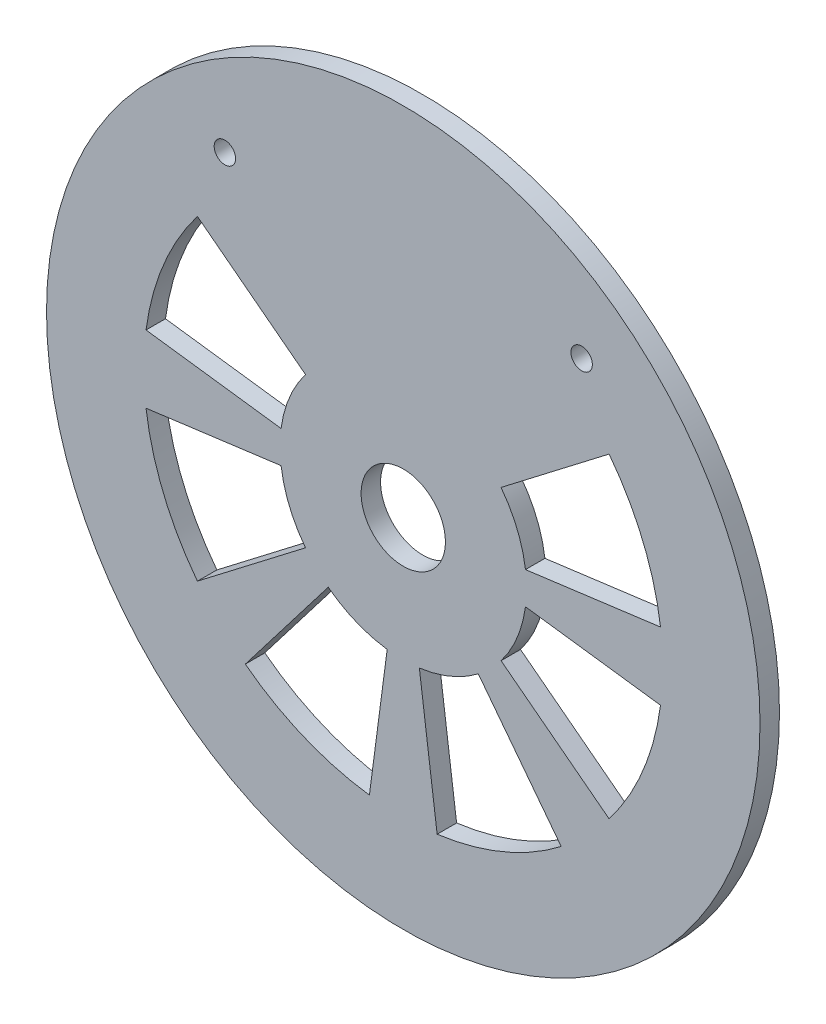
from build123d import *

# Parameters (mm, degrees)
SKETCH_1_R          = 55
EXTRUDE_1_DEPTH     = 3
SKETCH_3_R          = 1.65
CUT_EXTRUDE_1_DEPTH = 3
CUT_EXTRUDE_2_DEPTH = 3
SKETCH_5_R          = 6.5
CUT_EXTRUDE_3_DEPTH = 3


with BuildPart() as part:
    # 草图1 → 凸台-拉伸1 (new body)
    with BuildSketch(Plane.XY):
        Circle(SKETCH_1_R)
    extrude(amount=EXTRUDE_1_DEPTH)

    # 草图3 → 切除-拉伸1 (cut)
    with BuildSketch(Plane.XY.offset(3)):
        with Locations((27.5, 35)):
            Circle(SKETCH_3_R)
        with Locations((-27.5, 35)):
            Circle(SKETCH_3_R)
    extrude(amount=-CUT_EXTRUDE_1_DEPTH, mode=Mode.SUBTRACT)

    # 草图4 → 切除-拉伸2 (cut)
    with BuildSketch(Plane.XY.offset(3)):
        with BuildLine():
            ThreePointArc((15.073713466, 11.566467151), (17.553711118, 7.270985215), (18.837452366, 2.479997652))
            Line((18.837452366, 2.479997652), (39.657794455, 5.221047689))
            ThreePointArc((39.657794455, 5.221047689), (36.9551813, 15.307337295), (31.734133612, 24.35045716))
            Line((31.734133612, 24.35045716), (15.073713466, 11.566467151))
        make_face()
        with BuildLine():
            Line((-39.657794455, 5.221047689), (-18.837452366, 2.479997652))
            ThreePointArc((-18.837452366, 2.479997652), (-17.553711118, 7.270985215), (-15.073713466, 11.566467151))
            Line((-15.073713466, 11.566467151), (-31.734133612, 24.35045716))
            ThreePointArc((-31.734133612, 24.35045716), (-36.9551813, 15.307337295), (-39.657794455, 5.221047689))
        make_face()
        with BuildLine():
            Line((-31.734133612, -24.35045716), (-15.073713466, -11.566467151))
            ThreePointArc((-15.073713466, -11.566467151), (-17.553711118, -7.270985215), (-18.837452366, -2.479997652))
            Line((-18.837452366, -2.479997652), (-39.657794455, -5.221047689))
            ThreePointArc((-39.657794455, -5.221047689), (-36.9551813, -15.307337295), (-31.734133612, -24.35045716))
        make_face()
        with BuildLine():
            Line((-5.221047689, -39.657794455), (-2.479997652, -18.837452366))
            ThreePointArc((-2.479997652, -18.837452366), (-7.270985215, -17.553711118), (-11.566467151, -15.073713466))
            Line((-11.566467151, -15.073713466), (-24.35045716, -31.734133612))
            ThreePointArc((-24.35045716, -31.734133612), (-15.307337295, -36.9551813), (-5.221047689, -39.657794455))
        make_face()
        with BuildLine():
            Line((24.35045716, -31.734133612), (11.566467151, -15.073713466))
            ThreePointArc((11.566467151, -15.073713466), (7.270985215, -17.553711118), (2.479997652, -18.837452366))
            Line((2.479997652, -18.837452366), (5.221047689, -39.657794455))
            ThreePointArc((5.221047689, -39.657794455), (15.307337295, -36.9551813), (24.35045716, -31.734133612))
        make_face()
        with BuildLine():
            Line((39.657794455, -5.221047689), (18.837452366, -2.479997652))
            ThreePointArc((18.837452366, -2.479997652), (17.553711118, -7.270985215), (15.073713466, -11.566467151))
            Line((15.073713466, -11.566467151), (31.734133612, -24.35045716))
            ThreePointArc((31.734133612, -24.35045716), (36.9551813, -15.307337295), (39.657794455, -5.221047689))
        make_face()
    extrude(amount=-CUT_EXTRUDE_2_DEPTH, mode=Mode.SUBTRACT)

    # 草图5 → 切除-拉伸3 (cut)
    with BuildSketch(Plane.XY.offset(3)):
        Circle(SKETCH_5_R)
    extrude(amount=-CUT_EXTRUDE_3_DEPTH, mode=Mode.SUBTRACT)


solid = part.part
